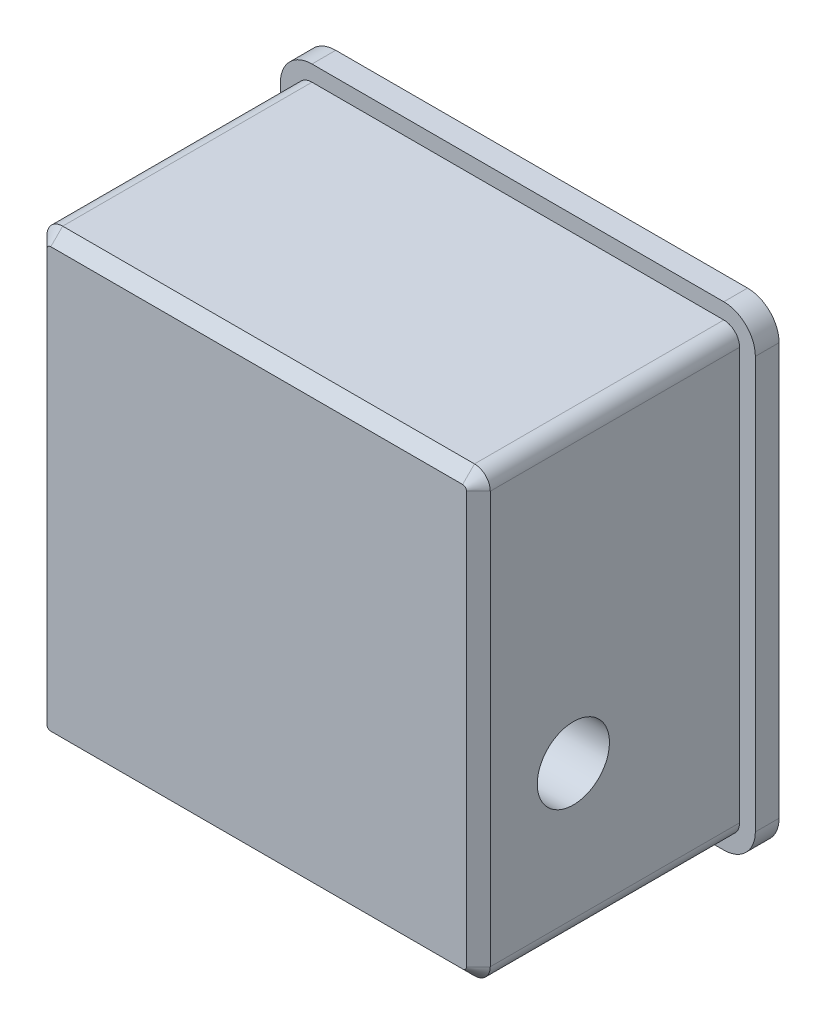
from build123d import *

# Parameters (mm, degrees)
BOSS_EXTRUDE1_DEPTH = 38.1
BOSS_EXTRUDE2_DEPTH = 3.175
SKETCH2_R           = 4.826
CUT_EXTRUDE1_DEPTH  = 79.921642198
CHAMFER1_SIZE       = 1.5875


with BuildPart() as part:
    # Sketch1 → Boss-Extrude1 (new body)
    with BuildSketch(Plane.XY):
        with BuildLine():
            ThreePointArc((29.6418, 27.5336), (29.024322516, 29.024322516), (27.5336, 29.6418))
            Line((27.5336, 29.6418), (-27.5336, 29.6418))
            ThreePointArc((-27.5336, 29.6418), (-29.024322516, 29.024322516), (-29.6418, 27.5336))
            Line((-29.6418, 27.5336), (-29.6418, -27.5336))
            ThreePointArc((-29.6418, -27.5336), (-29.024322516, -29.024322516), (-27.5336, -29.6418))
            Line((-27.5336, -29.6418), (27.5336, -29.6418))
            ThreePointArc((27.5336, -29.6418), (29.024322516, -29.024322516), (29.6418, -27.5336))
            Line((29.6418, -27.5336), (29.6418, 27.5336))
        make_face()
    extrude(amount=BOSS_EXTRUDE1_DEPTH)

    # Sketch1<3> → Boss-Extrude2 (add)
    with BuildSketch(Plane.XY):
        with BuildLine():
            Line((27.5336, 31.75), (-27.5336, 31.75))
            ThreePointArc((-27.5336, 31.75), (-30.515045032, 30.515045032), (-31.75, 27.5336))
            Line((-31.75, 27.5336), (-31.75, -27.5336))
            ThreePointArc((-31.75, -27.5336), (-30.515045032, -30.515045032), (-27.5336, -31.75))
            Line((-27.5336, -31.75), (27.5336, -31.75))
            ThreePointArc((27.5336, -31.75), (30.515045032, -30.515045032), (31.75, -27.5336))
            Line((31.75, -27.5336), (31.75, 27.5336))
            ThreePointArc((31.75, 27.5336), (30.515045032, 30.515045032), (27.5336, 31.75))
        make_face()
        with BuildLine():
            Line((27.5336, 29.6418), (-27.5336, 29.6418))
            ThreePointArc((-27.5336, 29.6418), (-29.024322516, 29.024322516), (-29.6418, 27.5336))
            Line((-29.6418, 27.5336), (-29.6418, -27.5336))
            ThreePointArc((-29.6418, -27.5336), (-29.024322516, -29.024322516), (-27.5336, -29.6418))
            Line((-27.5336, -29.6418), (27.5336, -29.6418))
            ThreePointArc((27.5336, -29.6418), (29.024322516, -29.024322516), (29.6418, -27.5336))
            Line((29.6418, -27.5336), (29.6418, 27.5336))
            ThreePointArc((29.6418, 27.5336), (29.024322516, 29.024322516), (27.5336, 29.6418))
        make_face(mode=Mode.SUBTRACT)
    extrude(amount=BOSS_EXTRUDE2_DEPTH)

    # Sketch2 → Cut-Extrude1 (cut, through all)
    with BuildSketch(Plane(origin=(29.6418, 0, 0), x_dir=(0, 0, -1), z_dir=(1, 0, 0))):
        with Locations((-25.4, -9.525)):
            Circle(SKETCH2_R)
    extrude(amount=-CUT_EXTRUDE1_DEPTH, mode=Mode.SUBTRACT)

    # Chamfer1
    chamfer1_edges = [part.edges().sort_by_distance(p)[0] for p in [
        (0, 29.6418, 38.1),
        (29.024322516, 29.024322516, 38.1),
        (-29.024322516, 29.024322516, 38.1),
        (29.6418, 0, 38.1),
        (-29.6418, 0, 38.1),
        (29.024322516, -29.024322516, 38.1),
        (-29.024322516, -29.024322516, 38.1),
        (0, -29.6418, 38.1),
    ]]
    chamfer(chamfer1_edges, length=CHAMFER1_SIZE)


solid = part.part
